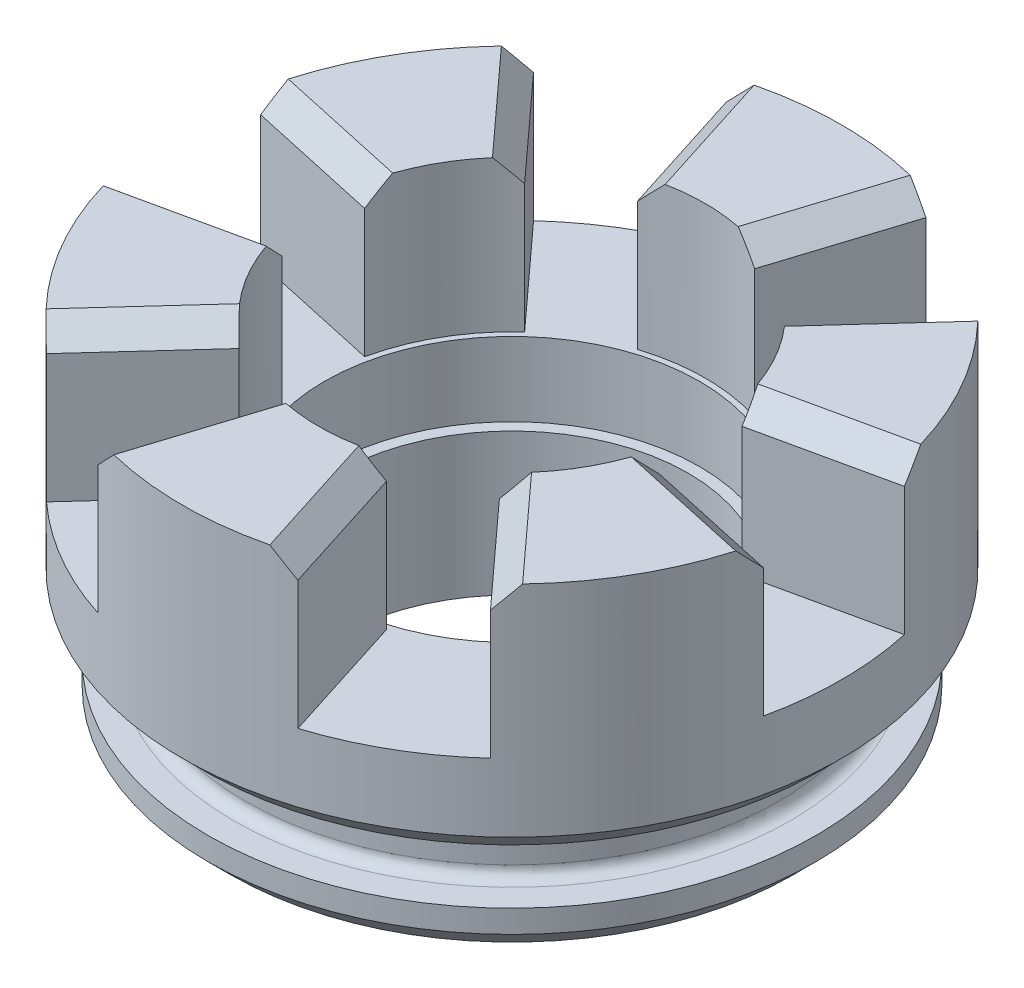
from build123d import *
from build123d.topology import SkipClean

# Parameters (mm, degrees)
BOSS_EXTRUDE1_DEPTH          = 13.3
CHAMFER1_SIZE                = 2
CIRPATTERN1_COUNT            = 6
CHAMFER1_OF_CIRPATTERN1_SIZE = 2
CHAMFER2_SIZE                = 2
FILLET1_R                    = 1


with BuildPart() as part:
    # Sketch1 → Revolve1 (revolve)
    with BuildSketch(Plane.XY, mode=Mode.PRIVATE) as revolve1_sk:
        Polygon((-16.5, 0), (-29, 0), (-29, -8), (-23.5, -8), (-23.5, -13), (-26.75, -13), (-26.75, -17), (-20.5, -17), (-20.5, -19), (-15.5, -19), (-15.5, -6.5), (-16.5, -6.5), align=None)
    revolve(revolve1_sk.sketch.rotate(Axis((0, 0, 0), (0, -1, 0)), 270), axis=Axis((0, 0, 0), (0, -1, 0)))

    # Sketch2 → Boss-Extrude1 (add)
    with SkipClean():  # the faces are left unmerged after this step: merging them gives an invalid solid
        with BuildSketch(Plane(origin=(0, 0, 0), x_dir=(1, 0, 0), z_dir=(0, 1, 0))):
            with BuildLine():
                Line((5.154427, 16.199749), (8.792846, 27.634867))
                ThreePointArc((8.792846, 27.634867), (0, 29), (-8.792846, 27.634867))
                Line((-8.792846, 27.634867), (-5.154427, 16.199749))
                ThreePointArc((-5.154427, 16.199749), (0, 17), (5.154427, 16.199749))
            make_face()
        boss_extrude1 = extrude(amount=BOSS_EXTRUDE1_DEPTH)

    # Chamfer1
    chamfer1_edges = [part.edges().sort_by_distance(p)[0] for p in [
        (6.973637, 13.3, -21.917308),
        (-6.973637, 13.3, -21.917308),
    ]]
    chamfer(chamfer1_edges, length=CHAMFER1_SIZE)

    # CirPattern1: Boss-Extrude1 ×6 about axis
    with SkipClean():  # the faces are left unmerged after this step: merging them gives an invalid solid
        cirpattern1_axis = Axis((0, 0, 0), (0, 1, 0))
        for i in range(1, CIRPATTERN1_COUNT):
            add(boss_extrude1.rotate(cirpattern1_axis, i * 360 / CIRPATTERN1_COUNT))

    # Chamfer1 of CirPattern1
    chamfer1_of_cirpattern1_edges = [part.edges().sort_by_distance(p)[0] for p in [
        (-15.494127, 13.3, -16.998),
        (-22.467764, 13.3, -4.919308),
        (-22.467764, 13.3, 4.919308),
        (-15.494127, 13.3, 16.998),
        (-6.973637, 13.3, 21.917308),
        (6.973637, 13.3, 21.917308),
        (15.494127, 13.3, 16.998),
        (22.467764, 13.3, 4.919308),
        (22.467764, 13.3, -4.919308),
        (15.494127, 13.3, -16.998),
    ]]
    chamfer(chamfer1_of_cirpattern1_edges, length=CHAMFER1_OF_CIRPATTERN1_SIZE)

    # Chamfer2
    chamfer2_edges = [part.edges().sort_by_distance(p)[0] for p in [
        (0, -17, -26.75),
        (0, -8, -29),
    ]]
    chamfer(chamfer2_edges, length=CHAMFER2_SIZE)

    # Fillet1
    fillet1_edges = [part.edges().sort_by_distance(p)[0] for p in [
        (0, -13, -23.5),
        (0, -8, -23.5),
    ]]
    fillet(fillet1_edges, radius=FILLET1_R)


solid = part.part
